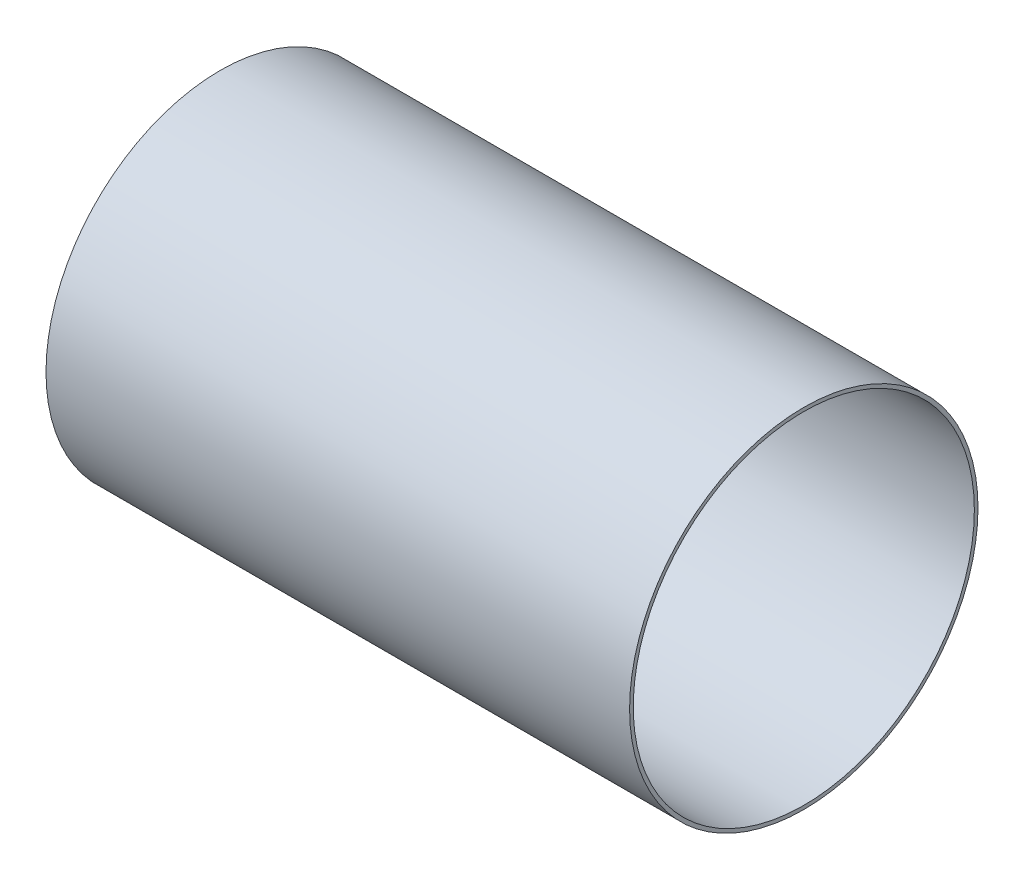
from build123d import *

# Parameters (mm, degrees)
SKETCH1_R           = 75.819
SKETCH1_R_2         = 74.2315
BOSS_EXTRUDE1_DEPTH = 254


with BuildPart() as part:
    # Sketch1 → Boss-Extrude1 (new body)
    with BuildSketch(Plane.YZ):
        with Locations(Location((0, 0, 0), (0, 0, 270))):
            Circle(SKETCH1_R)
        with Locations(Location((0, 0, 0), (0, 0, 270))):
            Circle(SKETCH1_R_2, mode=Mode.SUBTRACT)
    extrude(amount=BOSS_EXTRUDE1_DEPTH)


solid = part.part
